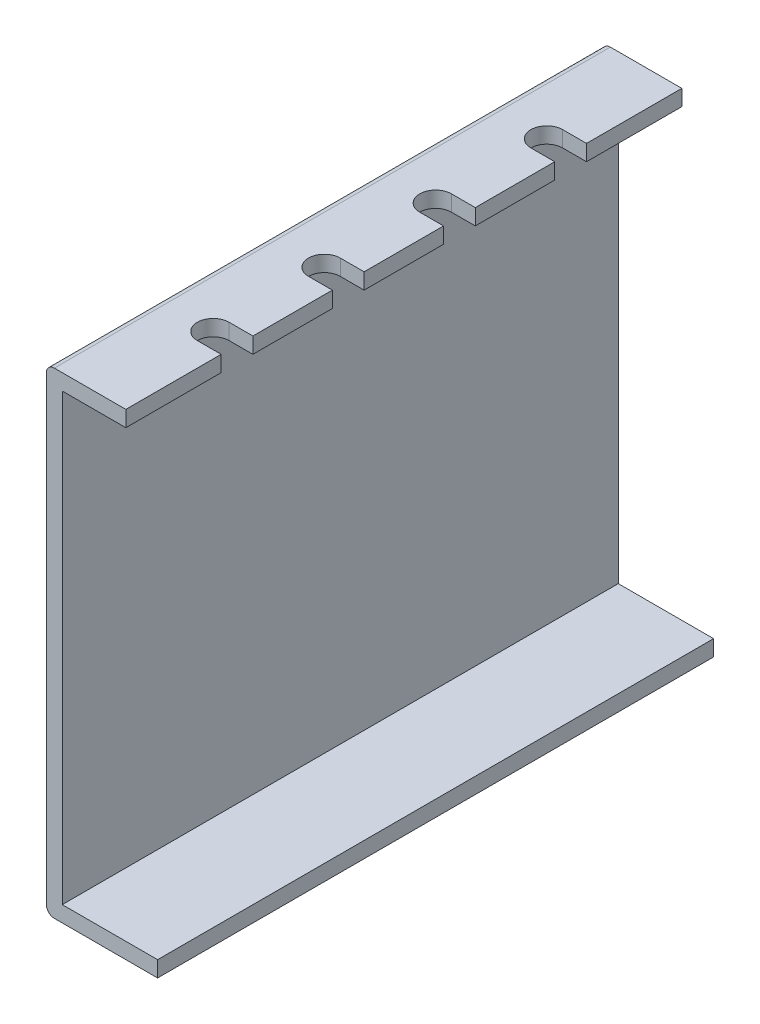
from build123d import *

# Parameters (mm, degrees)
BOSS_EXTRUDE1_DEPTH = 175
CUT_EXTRUDE1_REACH  = 356.295
LPATTERN1_COUNT     = 4
LPATTERN1_PITCH     = 70
FILLET1_R           = 5


with BuildPart() as part:
    # Sketch1 → Boss-Extrude1 (new, symmetric)
    with BuildSketch(Plane.XY):
        Polygon((0, 300), (0, 0), (70, 0), (70, 10), (10, 10), (10, 290), (50, 290), (50, 300), align=None)
    extrude(amount=BOSS_EXTRUDE1_DEPTH, both=True)

    # Sketch2 → Cut-Extrude1 (cut, up to next)
    with BuildSketch(Plane(origin=(0, 300, 0), x_dir=(1, 0, 0), z_dir=(0, 1, 0)), mode=Mode.PRIVATE) as cut_extrude1_sk1:
        with BuildLine():
            Line((35, 115), (50, 115))
            Line((50, 115), (50, 95))
            Line((50, 95), (35, 95))
            ThreePointArc((35, 95), (25, 105), (35, 115))
        make_face()
    cut_extrude1_tool1 = extrude(cut_extrude1_sk1.sketch, amount=-CUT_EXTRUDE1_REACH, mode=Mode.PRIVATE) & part.part
    cut_extrude1 = cut_extrude1_tool1.solids().sort_by_distance((38.464021, 300, -105))[0]
    add(cut_extrude1, mode=Mode.SUBTRACT)

    # LPattern1: Cut-Extrude1 ×4
    with Locations(*[(0, 0, i * LPATTERN1_PITCH) for i in range(1, LPATTERN1_COUNT)]):
        add(cut_extrude1, mode=Mode.SUBTRACT)

    # Fillet1
    fillet1_edges = [part.edges().sort_by_distance(p)[0] for p in [
        (0, 0, 0),
        (0, 300, 0),
    ]]
    fillet(fillet1_edges, radius=FILLET1_R)


solid = part.part
